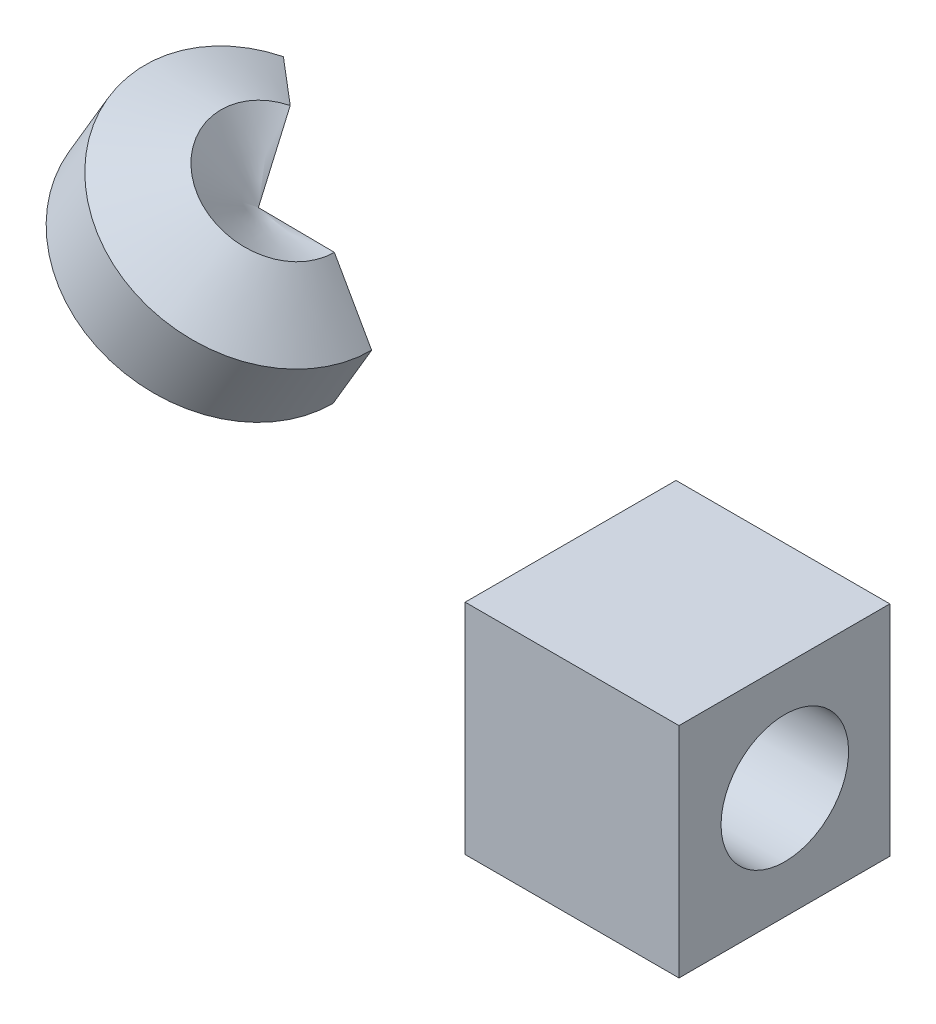
from build123d import *

# Parameters (mm, degrees)
SKETCH_1_W          = 22.308560603
SKETCH_1_H          = 22.806719796
EXTRUDE_1_DEPTH     = 22
SKETCH_11_R         = 6.652524896
CUT_EXTRUDE_1_DEPTH = 33
REVOLVE_1_ANGLE     = 229


with BuildPart() as part:
    # 草图1 → 凸台-拉伸1 (new body)
    with BuildSketch(Plane.XY):
        with Locations((-4.507095638, 19.02246425)):
            Rectangle(SKETCH_1_W, SKETCH_1_H)
    extrude(amount=EXTRUDE_1_DEPTH)

    # 草图11 → 切除-拉伸1 (cut)
    with BuildSketch(Plane.ZY.offset(15.661375939)):
        with Locations(Location((10.959794673, 19.258589263, 0), (0, 0, 270))):
            Circle(SKETCH_11_R)
    extrude(amount=-CUT_EXTRUDE_1_DEPTH, mode=Mode.SUBTRACT)


with BuildPart() as body_2:
    # 草图16 → 旋转1 (revolve)
    with BuildSketch(Plane(origin=(-29.556896168, 29.643832508, 22), x_dir=(1, 0, 0), z_dir=(0, 0, 1))):
        Polygon((-11.713079065, 18.824982723), (-7.820876875, 11.920554491), (0.104634468, 11.839086348), (4.13794362, 18.662046437), (0.245741431, 25.566474669), (-7.679769912, 25.647942812), align=None)
    revolve(axis=Axis((-37.23666608, 55.29177532, 22), (-0.5088751893161755, -0.860840311380936, 0)), revolution_arc=REVOLVE_1_ANGLE)


solid = Compound([part.part, body_2.part])
